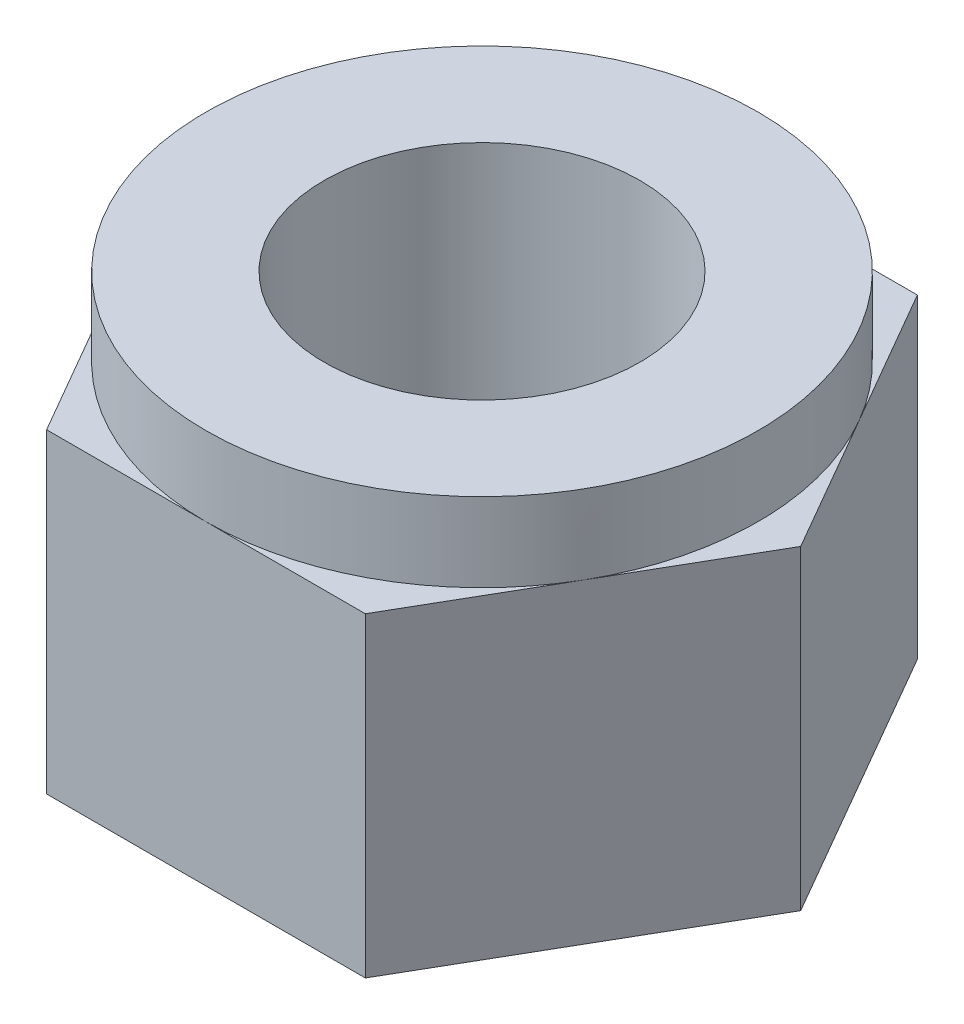
from build123d import *

# Parameters (mm, degrees)
EXTRUDE_1_DEPTH     = 4
SKETCH_2_R          = 3.5
EXTRUDE_2_DEPTH     = 1
SKETCH_3_R          = 2
CUT_EXTRUDE_1_DEPTH = 8.320063752


with BuildPart() as part:
    # 草图1 → 凸台-拉伸1 (new body)
    with BuildSketch(Plane(origin=(0, 0, 0), x_dir=(1, 0, 0), z_dir=(0, 1, 0))):
        Polygon((4.041451884, 0), (2.020725942, 3.5), (-2.020725942, 3.5), (-4.041451884, 0), (-2.020725942, -3.5), (2.020725942, -3.5), align=None)
    extrude(amount=EXTRUDE_1_DEPTH)

    # 草图2 → 凸台-拉伸2 (add)
    with BuildSketch(Plane(origin=(0, 4, 0), x_dir=(1, 0, 0), z_dir=(0, 1, 0))):
        Circle(SKETCH_2_R)
    extrude(amount=EXTRUDE_2_DEPTH)

    # 草图3 → 切除-拉伸1 (cut, through all)
    with BuildSketch(Plane.XZ):
        Circle(SKETCH_3_R)
    extrude(amount=-CUT_EXTRUDE_1_DEPTH, mode=Mode.SUBTRACT)


solid = part.part
